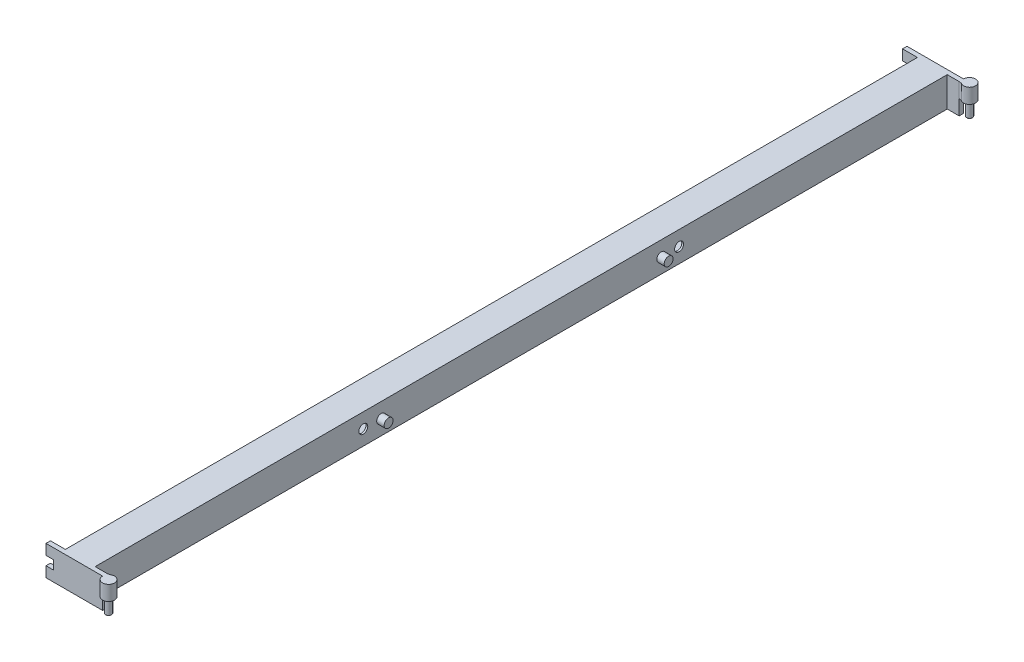
from build123d import *

# Parameters (mm, degrees)
BOSS_EXTRUDE1_DEPTH      = 286
BOSS_EXTRUDE1_DEPTH_BACK = 286
SKETCH1_W                = 20
SKETCH1_H                = 20
SKETCH1_W_2              = 17.6
SKETCH1_H_2              = 17.6
SKETCH2_W                = 36
SKETCH2_H                = 20
BOSS_EXTRUDE2_DEPTH      = 3
SKETCH3_R                = 3
CUT_EXTRUDE1_DEPTH       = 308.748273756
BOSS_EXTRUDE3_DEPTH      = 10
SKETCH5_R                = 2
BOSS_EXTRUDE4_DEPTH      = 10
CHAMFER1_SIZE            = 0.5
SKETCH6_W                = 36
SKETCH6_H                = 20
BOSS_EXTRUDE5_DEPTH      = 3
CHAMFER2_SIZE            = 0.5
SKETCH7_W                = 3
SKETCH7_H                = 20
BOSS_EXTRUDE6_DEPTH      = 2
SKETCH8_W                = 3
SKETCH8_H                = 6
CUT_EXTRUDE2_DEPTH       = 5
BOSS_EXTRUDE7_DEPTH      = 2
BOSS_EXTRUDE7_DEPTH_BACK = 25
SKETCH9_R                = 3


with BuildPart() as part:
    # Sketch1 → Boss-Extrude1 (new, two sides: drawn at the far end of the back side and taken through both)
    with BuildSketch(Plane.XY.offset(-BOSS_EXTRUDE1_DEPTH_BACK)):
        with Locations((0, -92)):
            Rectangle(SKETCH1_W, SKETCH1_H)
        with Locations((0, -92)):
            Rectangle(SKETCH1_W_2, SKETCH1_H_2, mode=Mode.SUBTRACT)
    extrude(amount=BOSS_EXTRUDE1_DEPTH + BOSS_EXTRUDE1_DEPTH_BACK)

    # Sketch2 → Boss-Extrude2 (add)
    with BuildSketch(Plane(origin=(0, 0, -286), x_dir=(-1, 0, 0), z_dir=(0, 0, -1))):
        with Locations((0, -92)):
            Rectangle(SKETCH2_W, SKETCH2_H)
    extrude(amount=BOSS_EXTRUDE2_DEPTH)

    # Sketch3 → Cut-Extrude1 (cut, through all)
    with BuildSketch(Plane(origin=(10, 0, 0), x_dir=(0, 0, -1), z_dir=(1, 0, 0))):
        with Locations((-106, -92)):
            Circle(SKETCH3_R)
        with Locations((-94, -92)):
            Circle(SKETCH3_R)
        with Locations((94, -92)):
            Circle(SKETCH3_R)
        with Locations((106, -92)):
            Circle(SKETCH3_R)
    extrude(amount=-CUT_EXTRUDE1_DEPTH, mode=Mode.SUBTRACT)

    # Sketch4 → Boss-Extrude3 (add)
    with BuildSketch(Plane(origin=(0, -82, 0), x_dir=(1, 0, 0), z_dir=(0, 1, 0))):
        with BuildLine():
            Line((18, 286), (19.722941986, 285.711382236))
            ThreePointArc((19.722941986, 285.711382236), (25.543178803, 290.856309234), (18, 289))
            Line((18, 289), (18, 286))
        make_face()
    boss_extrude3 = extrude(amount=-BOSS_EXTRUDE3_DEPTH)

    # Sketch5 → Boss-Extrude4 (add)
    with BuildSketch(Plane.XZ.offset(92)):
        with Locations(Location((22, -289, 0), (0, 0, 90))):
            Circle(SKETCH5_R)
    boss_extrude4 = extrude(amount=BOSS_EXTRUDE4_DEPTH)

    # Chamfer1
    chamfer1_edges = [part.edges().sort_by_distance(p)[0] for p in [
        (22, -102, -291),
    ]]
    chamfer(chamfer1_edges, length=CHAMFER1_SIZE)

    # Sketch6 → Boss-Extrude5 (add)
    with BuildSketch(Plane.XY.offset(286)):
        with Locations((0, -92)):
            Rectangle(SKETCH6_W, SKETCH6_H)
    extrude(amount=BOSS_EXTRUDE5_DEPTH)

    # Mirror5: Boss-Extrude3, Boss-Extrude4 across plane
    add(boss_extrude3.mirror(Plane.XY))
    add(boss_extrude4.mirror(Plane.XY))

    # Chamfer2
    chamfer2_edges = [part.edges().sort_by_distance(p)[0] for p in [
        (22, -102, 291),
    ]]
    chamfer(chamfer2_edges, length=CHAMFER2_SIZE)

    # Sketch7 → Boss-Extrude6 (add)
    with BuildSketch(Plane.ZY.offset(18)):
        with Locations((287.5, -92)):
            Rectangle(SKETCH7_W, SKETCH7_H)
    boss_extrude6 = extrude(amount=BOSS_EXTRUDE6_DEPTH)

    # Sketch8 → Cut-Extrude2 (cut)
    with BuildSketch(Plane.ZY.offset(20)):
        with Locations((287.5, -92)):
            Rectangle(SKETCH8_W, SKETCH8_H)
    cut_extrude2 = extrude(amount=-CUT_EXTRUDE2_DEPTH, mode=Mode.SUBTRACT)

    # Mirror6: Boss-Extrude6, Cut-Extrude2 across plane
    add(boss_extrude6.mirror(Plane.XY))
    add(cut_extrude2.mirror(Plane.XY), mode=Mode.SUBTRACT)

    # Sketch9 → Boss-Extrude7 (add, two sides: drawn at the far end of the back side and taken through both)
    with BuildSketch(Plane.ZY.offset(10).offset(-BOSS_EXTRUDE7_DEPTH_BACK)):
        with Locations(Location((94, -92, 0), (0, 0, 90))):
            Circle(SKETCH9_R)
        with Locations(Location((-94, -92, 0), (0, 0, 90))):
            Circle(SKETCH9_R)
    extrude(amount=BOSS_EXTRUDE7_DEPTH + BOSS_EXTRUDE7_DEPTH_BACK)


solid = part.part
